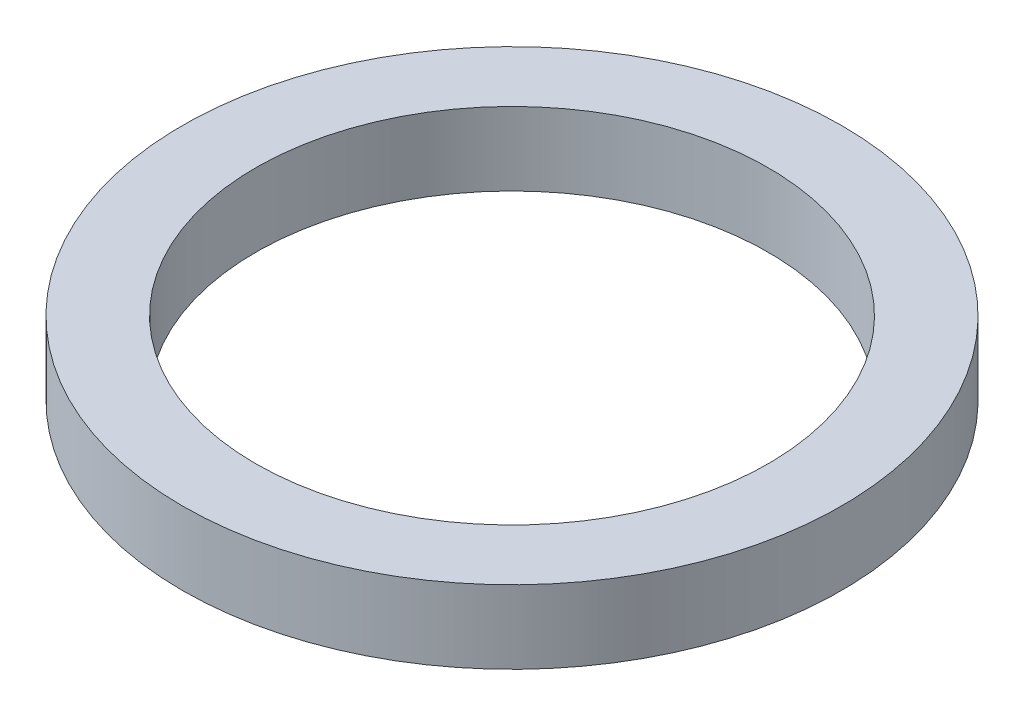
from build123d import *

# Parameters (mm, degrees)
SKETCH_1_R      = 22.5
SKETCH_1_R_2    = 17.5
EXTRUDE_1_DEPTH = 5


with BuildPart() as part:
    # 草图1 → 凸台-拉伸1 (new body)
    with BuildSketch(Plane(origin=(0, 0, 0), x_dir=(1, 0, 0), z_dir=(0, 1, 0))):
        with Locations(Location((0, 0, 0), (0, 0, 270))):
            Circle(SKETCH_1_R)
        with Locations(Location((0, 0, 0), (0, 0, 270))):
            Circle(SKETCH_1_R_2, mode=Mode.SUBTRACT)
    extrude(amount=EXTRUDE_1_DEPTH)


solid = part.part
